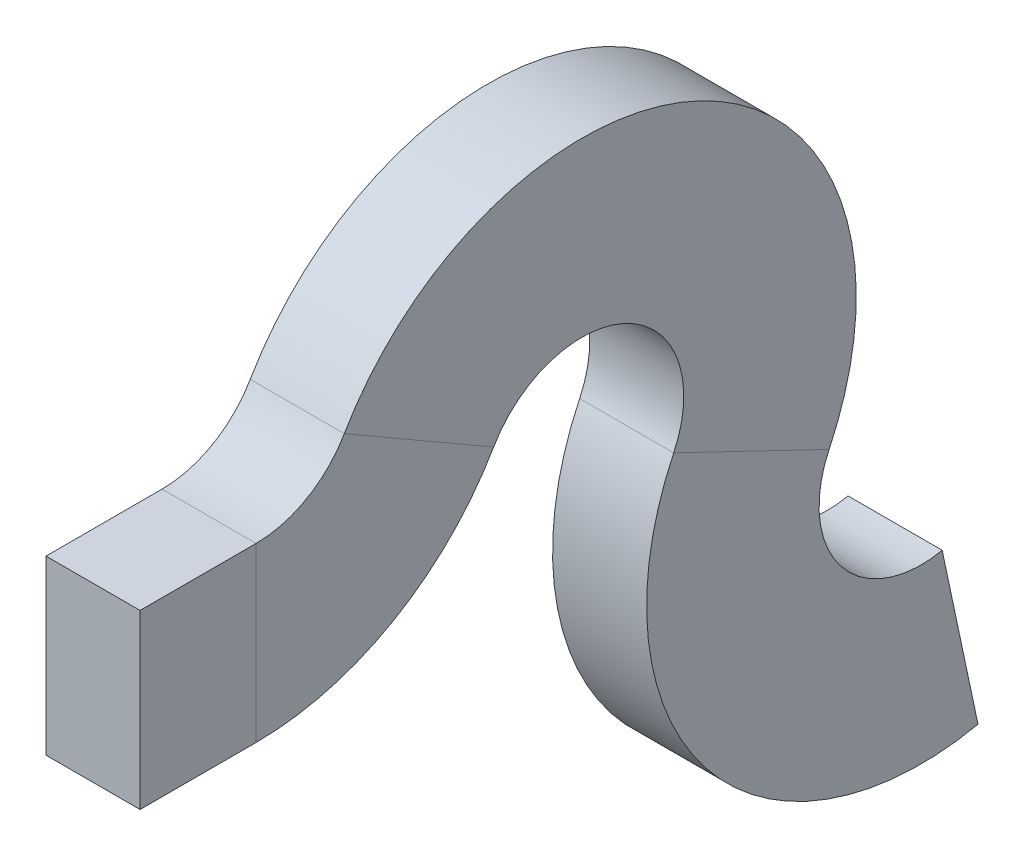
from build123d import *

# Parameters (mm, degrees)
SKETCH_264_W = 30
SKETCH_264_H = 55


with BuildPart() as part:
    # По траектории2: sweep along a path in Sketch 339
    with BuildLine(Plane(origin=(0, 0, 0), x_dir=(0, 0, -1), z_dir=(1, 0, 0))) as sweep_2_path:
        Line((0, 0), (37, 0))
        ThreePointArc((37, 0), (67, 8.038475773), (88.961524227, 30))
        ThreePointArc((88.961524227, 30), (168.942963927, 53.05548357), (194.997071793, -26))
        ThreePointArc((194.997071793, -26), (201.894019343, -89.07186966), (261.54579658, -110.688856044))
    # Sketch 264 → По траектории2 (sweep)
    with BuildSketch(Plane.XY):
        Rectangle(SKETCH_264_W, SKETCH_264_H)
    sweep(path=sweep_2_path.line)


solid = part.part
